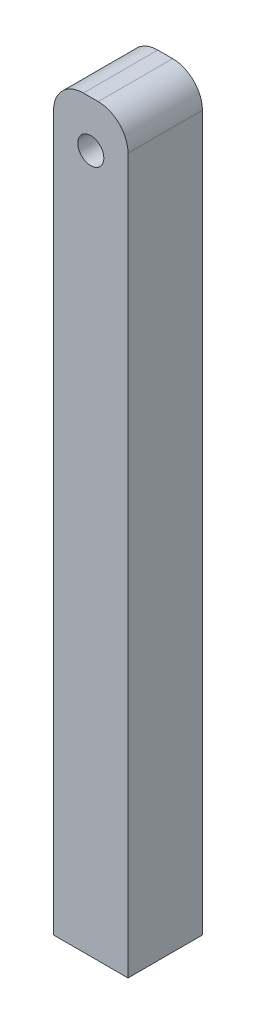
from build123d import *

# Parameters (mm, degrees)
SALIENTE_EXTRUIR2_DEPTH = 10
CROQUIS2_R              = 1.75
CORTAR_EXTRUIR1_DEPTH   = 3


with BuildPart() as part:
    # Croquis1 → Saliente-Extruir2 (new body)
    with BuildSketch(Plane.XY):
        with BuildLine():
            Line((5, -50), (-5, -50))
            Line((-5, -50), (-5, 46))
            ThreePointArc((-5, 46), (-3.828427125, 48.828427125), (-1, 50))
            Line((-1, 50), (1, 50))
            ThreePointArc((1, 50), (3.828427125, 48.828427125), (5, 46))
            Line((5, 46), (5, -50))
        make_face()
    extrude(amount=SALIENTE_EXTRUIR2_DEPTH)

    # Croquis2 → Cortar-Extruir1 (cut)
    with BuildSketch(Plane.XY.offset(10)):
        with Locations((0, 43.791816943)):
            Circle(CROQUIS2_R)
    extrude(amount=-CORTAR_EXTRUIR1_DEPTH, mode=Mode.SUBTRACT)


solid = part.part
